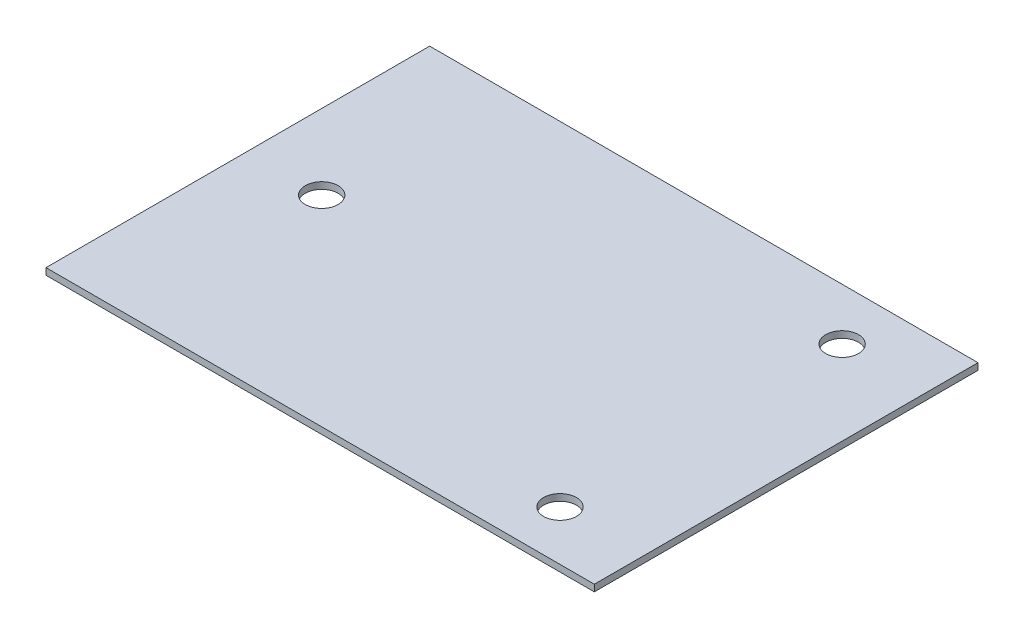
from build123d import *

# Parameters (mm, degrees)
SKETCH1_W           = 53.515278819
SKETCH1_H           = 1.25
BOSS_EXTRUDE1_DEPTH = 0.65
SKETCH2_R           = 1.6
CUT_EXTRUDE1_DEPTH  = 41.32396752


with BuildPart() as part:
    # Sketch1 → Boss-Extrude1 (new body)
    with BuildSketch(Plane(origin=(0, 0, 0), x_dir=(1, 0, 0), z_dir=(0, 1, 0))):
        Polygon((-27.428763177, -6.643775098), (-27.428763177, 29.222168516), (-27.428763177, 29.551020407), (26.086515642, 29.551020407), (26.086515642, 28.356224902), (26.086515642, -6.643775098), align=None)
        with Locations((-0.671123767, -7.268775098)):
            Rectangle(SKETCH1_W, SKETCH1_H)
    extrude(amount=BOSS_EXTRUDE1_DEPTH)

    # Sketch2 → Cut-Extrude1 (cut, through all)
    with BuildSketch(Plane.XZ):
        with Locations(Location((-20.106484358, -11.691224902, 0), (0, 0, 270))):
            Circle(SKETCH2_R)
        with Locations(Location((17.882515642, -24.493824902, 0), (0, 0, 270))):
            Circle(SKETCH2_R)
        with Locations(Location((17.882515642, 3.040775098, 0), (0, 0, 270))):
            Circle(SKETCH2_R)
    extrude(amount=-CUT_EXTRUDE1_DEPTH, mode=Mode.SUBTRACT)


solid = part.part
